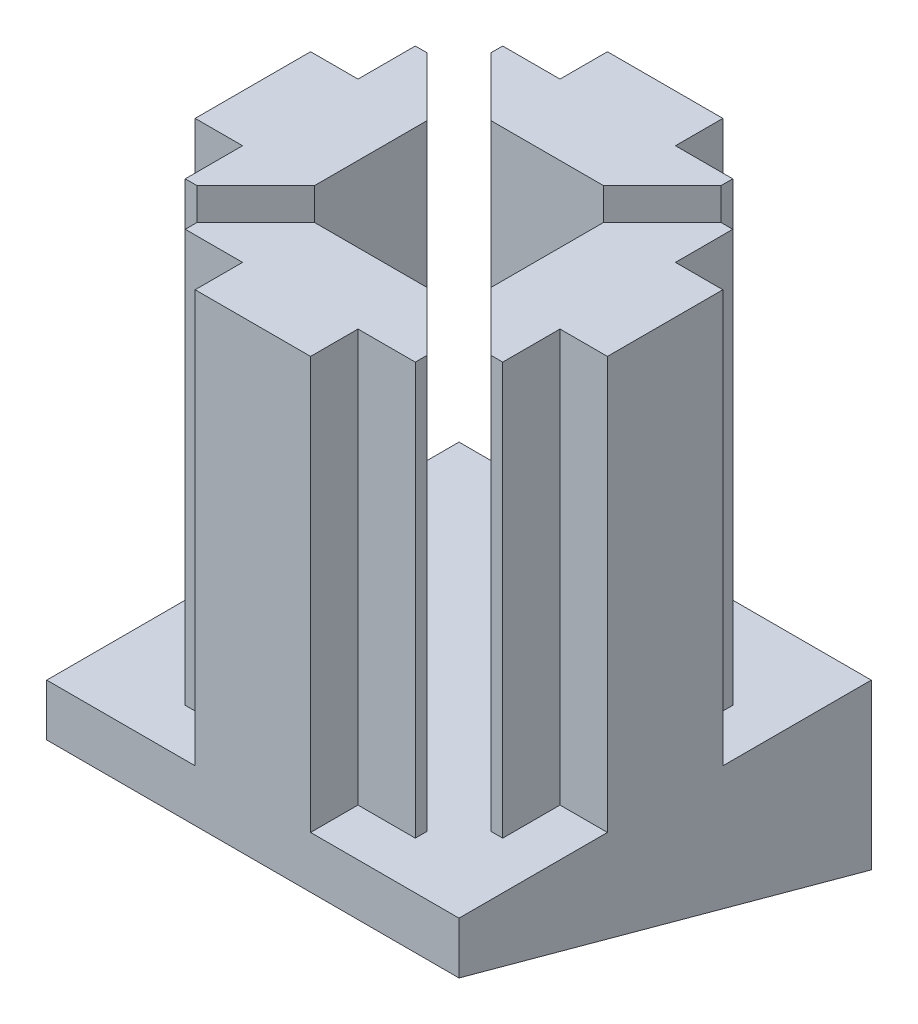
from build123d import *

# Parameters (mm, degrees)
BOSS_EXTRUDE1_DEPTH   = 20
BOSS_EXTRUDE1_2_DEPTH = 20
BOSS_EXTRUDE1_3_DEPTH = 20
BOSS_EXTRUDE1_4_DEPTH = 20
SKETCH2_W             = 20
SKETCH2_H             = 20
BOSS_EXTRUDE2_DEPTH   = 20
CUT_EXTRUDE1_DEPTH    = 31


with BuildPart() as part:
    # Sketch1 → Boss-Extrude1 (new body)
    with BuildSketch(Plane(origin=(0, 0, 0), x_dir=(1, 0, 0), z_dir=(0, 1, 0))):
        Polygon((-10, -2.8), (-10, 2.8), (-7.7, 2.8), (-7.7, 5.58), (-7.135634919, 5.58), (-4.28, 2.724365081), (-4.28, -2.724365081), (-7.135634919, -5.58), (-7.7, -5.58), (-7.7, -2.8), align=None)
    extrude(amount=BOSS_EXTRUDE1_DEPTH)



with BuildPart() as body_2:
    # Sketch1 → Boss-Extrude1 2 (new body)
    with BuildSketch(Plane(origin=(0, 0, 0), x_dir=(1, 0, 0), z_dir=(0, 1, 0))):
        Polygon((10, 2.8), (7.7, 2.8), (7.7, 5.58), (7.135634919, 5.58), (4.28, 2.724365081), (4.28, -2.724365081), (7.135634919, -5.58), (7.7, -5.58), (7.7, -2.8), (10, -2.8), align=None)
    extrude(amount=BOSS_EXTRUDE1_2_DEPTH)


with BuildPart() as body_3:
    # Sketch1 → Boss-Extrude1 3 (new body)
    with BuildSketch(Plane(origin=(0, 0, 0), x_dir=(1, 0, 0), z_dir=(0, 1, 0))):
        Polygon((2.8, -10), (-2.8, -10), (-2.8, -7.7), (-5.58, -7.7), (-5.58, -7.135634919), (-2.724365081, -4.28), (2.724365081, -4.28), (5.58, -7.135634919), (5.58, -7.7), (2.8, -7.7), align=None)
    extrude(amount=BOSS_EXTRUDE1_3_DEPTH)


with BuildPart() as body_4:
    # Sketch1 → Boss-Extrude1 4 (new body)
    with BuildSketch(Plane(origin=(0, 0, 0), x_dir=(1, 0, 0), z_dir=(0, 1, 0))):
        Polygon((-2.8, 10), (-2.8, 7.7), (-5.58, 7.7), (-5.58, 7.135634919), (-2.724365081, 4.28), (2.724365081, 4.28), (5.58, 7.135634919), (5.58, 7.7), (2.8, 7.7), (2.8, 10), align=None)
    extrude(amount=BOSS_EXTRUDE1_4_DEPTH)


with BuildPart() as part_1:
    add(part.part)

    add(body_2.part)  # Boss-Extrude2 merges body 2

    add(body_3.part)  # Boss-Extrude2 merges body 3

    add(body_4.part)  # Boss-Extrude2 merges body 4
    # Sketch2 → Boss-Extrude2 (add)
    with BuildSketch(Plane.XZ):
        Rectangle(SKETCH2_W, SKETCH2_H)
    extrude(amount=BOSS_EXTRUDE2_DEPTH)

    # Sketch3 → Cut-Extrude1 (cut, through all)
    with BuildSketch(Plane(origin=(10, 0, 0), x_dir=(0, 0, -1), z_dir=(1, 0, 0))):
        Polygon((10.596673941, -8.137212268), (10.596673941, -38.345549702), (-10.411138478, -38.345549702), (-10.411138478, -2.402671747), align=None)
    extrude(amount=-CUT_EXTRUDE1_DEPTH, mode=Mode.SUBTRACT)


solid = part_1.part
